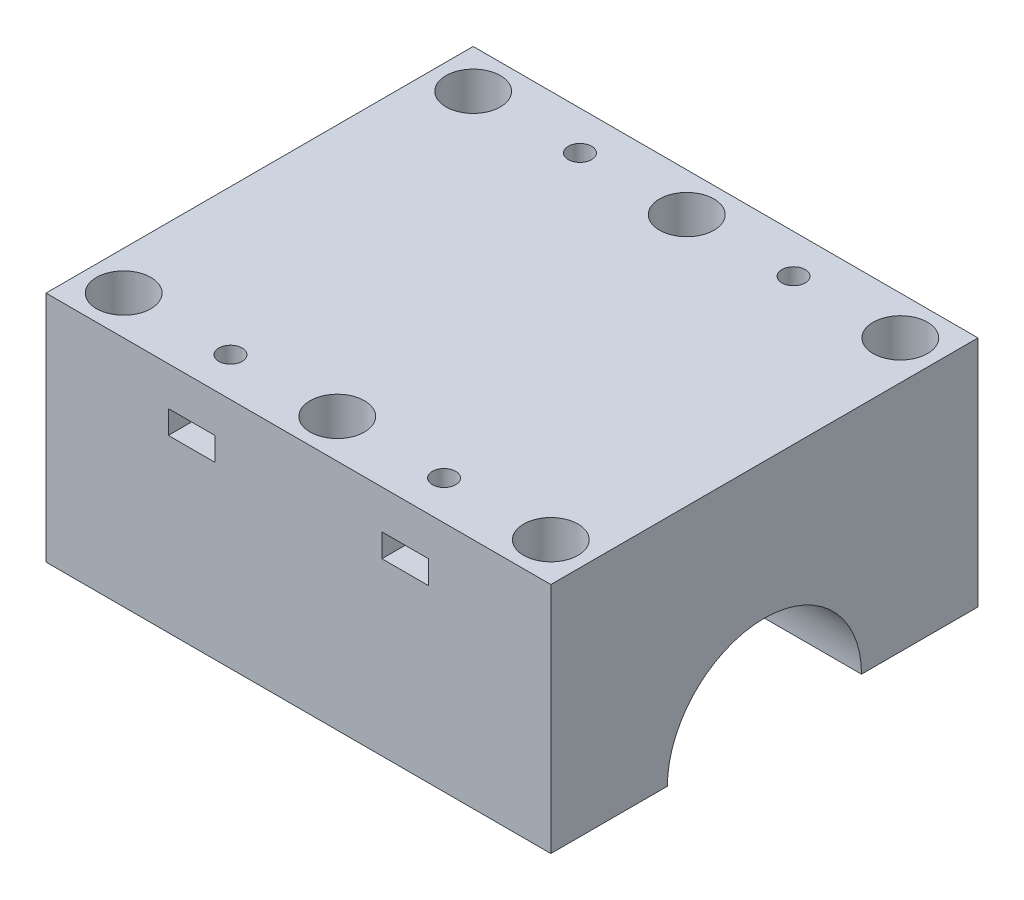
from build123d import *

# Parameters (mm, degrees)
CROQUIS2_W              = 65
CROQUIS2_H              = 55
CROQUIS2_R              = 1.5
SALIENTE_EXTRUIR1_DEPTH = 5
CROQUIS4_W              = 65
CROQUIS4_H              = 55
CROQUIS4_R              = 3.5
SALIENTE_EXTRUIR2_DEPTH = 25
CROQUIS6_R              = 12.5
CORTAR_EXTRUIR1_DEPTH   = 60
CROQUIS7_R              = 6.5
CORTAR_EXTRUIR2_DEPTH   = 5
CROQUIS8_R              = 1.5
CORTAR_EXTRUIR3_DEPTH   = 10
CROQUIS9_W              = 6
CROQUIS9_H              = 3
CORTAR_EXTRUIR6_DEPTH   = 10


with BuildPart() as part:
    # Croquis2 → Saliente-Extruir1 (new body)
    with BuildSketch(Plane(origin=(0, 0, 0), x_dir=(1, 0, 0), z_dir=(0, 1, 0))):
        with Locations((32.5, 27.5)):
            Rectangle(CROQUIS2_W, CROQUIS2_H)
        with Locations(Location((5, 50, 0), (0, 0, 270))):
            Circle(CROQUIS2_R, mode=Mode.SUBTRACT)
        with Locations(Location((32.5, 50, 0), (0, 0, 270))):
            Circle(CROQUIS2_R, mode=Mode.SUBTRACT)
        with Locations(Location((60, 50, 0), (0, 0, 270))):
            Circle(CROQUIS2_R, mode=Mode.SUBTRACT)
        with Locations(Location((5, 5, 0), (0, 0, 270))):
            Circle(CROQUIS2_R, mode=Mode.SUBTRACT)
        with Locations(Location((32.5, 5, 0), (0, 0, 270))):
            Circle(CROQUIS2_R, mode=Mode.SUBTRACT)
        with Locations(Location((60, 5, 0), (0, 0, 270))):
            Circle(CROQUIS2_R, mode=Mode.SUBTRACT)
    extrude(amount=SALIENTE_EXTRUIR1_DEPTH)

    # Croquis4 → Saliente-Extruir2 (add)
    with BuildSketch(Plane(origin=(0, 5, 0), x_dir=(1, 0, 0), z_dir=(0, 1, 0))):
        with Locations((32.5, 27.5)):
            Rectangle(CROQUIS4_W, CROQUIS4_H)
        with Locations(Location((5, 50, 0), (0, 0, 270))):
            Circle(CROQUIS4_R, mode=Mode.SUBTRACT)
        with Locations(Location((32.5, 50, 0), (0, 0, 270))):
            Circle(CROQUIS4_R, mode=Mode.SUBTRACT)
        with Locations(Location((60, 50, 0), (0, 0, 270))):
            Circle(CROQUIS4_R, mode=Mode.SUBTRACT)
        with Locations(Location((60, 5, 0), (0, 0, 270))):
            Circle(CROQUIS4_R, mode=Mode.SUBTRACT)
        with Locations(Location((32.5, 5, 0), (0, 0, 270))):
            Circle(CROQUIS4_R, mode=Mode.SUBTRACT)
        with Locations(Location((5, 5, 0), (0, 0, 270))):
            Circle(CROQUIS4_R, mode=Mode.SUBTRACT)
    extrude(amount=SALIENTE_EXTRUIR2_DEPTH)

    # Croquis6 → Cortar-Extruir1 (cut)
    with BuildSketch(Plane(origin=(65, 0, 0), x_dir=(0, 0, -1), z_dir=(1, 0, 0))):
        with Locations((27.5, 0)):
            Circle(CROQUIS6_R)
    extrude(amount=-CORTAR_EXTRUIR1_DEPTH, mode=Mode.SUBTRACT)

    # Croquis7 → Cortar-Extruir2 (cut)
    with BuildSketch(Plane.ZY):
        with Locations((-27.5, 0)):
            Circle(CROQUIS7_R)
    extrude(amount=-CORTAR_EXTRUIR2_DEPTH, mode=Mode.SUBTRACT)

    # Croquis8 → Cortar-Extruir3 (cut)
    with BuildSketch(Plane(origin=(0, 30, 0), x_dir=(1, 0, 0), z_dir=(0, 1, 0))):
        with Locations(Location((18.75, 50, 0), (0, 0, 270))):
            Circle(CROQUIS8_R)
        with Locations(Location((46.25, 50, 0), (0, 0, 270))):
            Circle(CROQUIS8_R)
        with Locations(Location((46.25, 5, 0), (0, 0, 270))):
            Circle(CROQUIS8_R)
        with Locations(Location((18.75, 5, 0), (0, 0, 270))):
            Circle(CROQUIS8_R)
    extrude(amount=-CORTAR_EXTRUIR3_DEPTH, mode=Mode.SUBTRACT)

    # Croquis9 → Cortar-Extruir6 (cut)
    with BuildSketch(Plane.XY):
        with Locations((18.75, 23.5)):
            Rectangle(CROQUIS9_W, CROQUIS9_H)
        with Locations((46.25, 23.5)):
            Rectangle(CROQUIS9_W, CROQUIS9_H)
    cortar_extruir6 = extrude(amount=-CORTAR_EXTRUIR6_DEPTH, mode=Mode.SUBTRACT)

    # Simetría1: Cortar-Extruir6 across plane
    add(cortar_extruir6.mirror(Plane.XY.offset(-27.5)), mode=Mode.SUBTRACT)


solid = part.part
